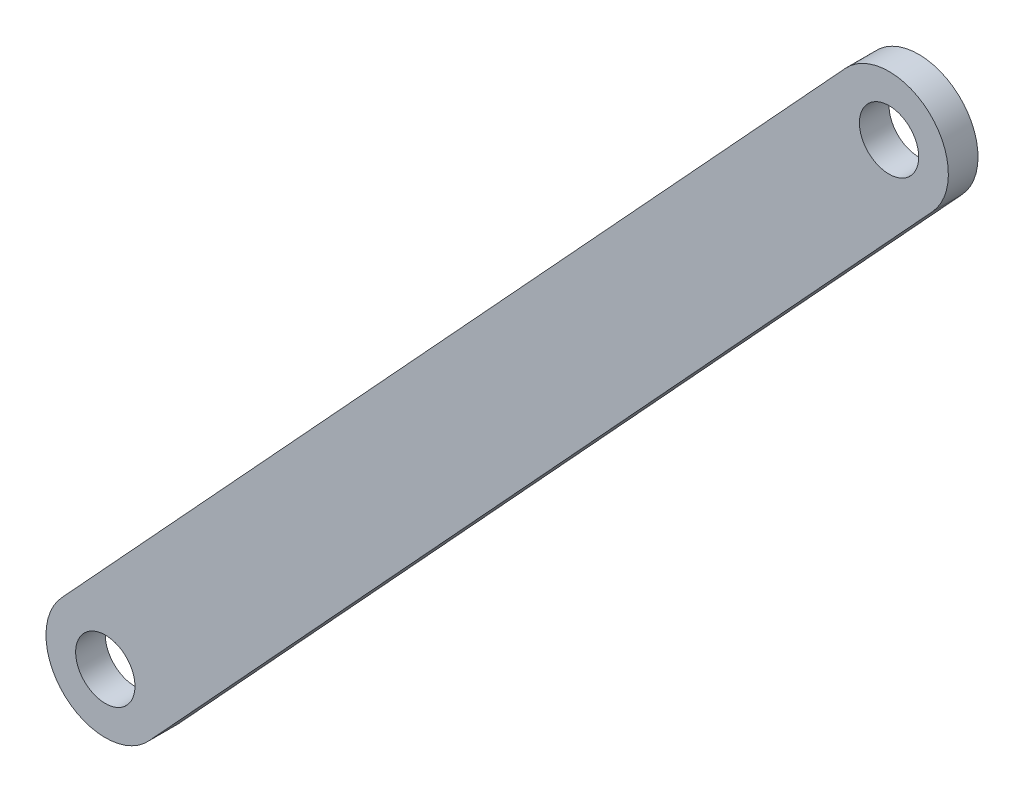
from build123d import *

# Parameters (mm, degrees)
BOSS_EXTRUDE1_START = 1.5875
SKETCH1_R           = 1.5875
BOSS_EXTRUDE1_DEPTH = 1.5875


with BuildPart() as part:
    # Sketch1 → Boss-Extrude1 (new body)
    with BuildSketch(Plane.XY.offset(BOSS_EXTRUDE1_START)):
        with BuildLine():
            Line((17.334582638, -2.151824553), (-24.617524394, -47.666994723))
            ThreePointArc((-24.617524394, -47.666994723), (-29.103931584, -47.849752808), (-29.28668967, -43.363345617))
            Line((-29.28668967, -43.363345617), (12.665417362, 2.151824553))
            ThreePointArc((12.665417362, 2.151824553), (17.151824553, 2.334582638), (17.334582638, -2.151824553))
        make_face()
        with Locations((-26.952107032, -45.51517017)):
            Circle(SKETCH1_R, mode=Mode.SUBTRACT)
        with Locations((15, 0)):
            Circle(SKETCH1_R, mode=Mode.SUBTRACT)
    extrude(amount=BOSS_EXTRUDE1_DEPTH)


solid = part.part
